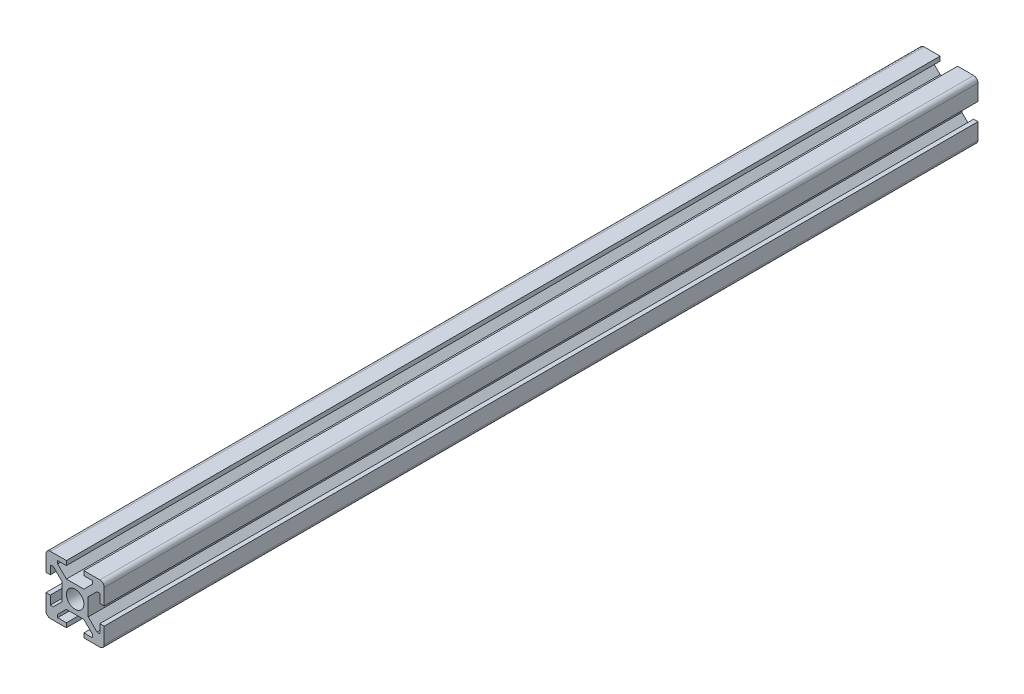
from build123d import *

# Parameters (mm, degrees)
ESQUISSE1_W                  = 20
ESQUISSE1_H                  = 20
EXTRUSION1_DEPTH             = 150
CONG_1_R                     = 1.5
ENL_V_MAT_EXTRU_1_DEPTH      = 301.333148354
R_P_TITION_CIRCULAIRE1_COUNT = 4


with BuildPart() as part:
    # Esquisse1 → Extrusion1 (new, symmetric)
    with BuildSketch(Plane.XY):
        Rectangle(ESQUISSE1_W, ESQUISSE1_H)
    extrude(amount=EXTRUSION1_DEPTH, both=True)

    # Congé1
    cong_1_edges = [part.edges().sort_by_distance(p)[0] for p in [
        (-10, -10, 0),
        (10, -10, 0),
        (-10, 10, 0),
        (10, 10, 0),
    ]]
    fillet(cong_1_edges, radius=CONG_1_R)

    # Esquisse2 → Enlèv. mat.-Extru.1 (cut, through all)
    with BuildSketch(Plane(origin=(0, 0, -150), x_dir=(-1, 0, 0), z_dir=(0, 0, -1))):
        Polygon((-10, 3), (-10, -3), (-8.5, -3), (-8.5, -6), (-7.5, -6), (-4.5, -3), (-4.5, 3), (-7.5, 6), (-8.5, 6), (-8.5, 3), align=None)
    enl_v_mat_extru_1 = extrude(amount=-ENL_V_MAT_EXTRU_1_DEPTH, mode=Mode.SUBTRACT)

    # Répétition circulaire1: Enlèv. mat.-Extru.1 ×4 about axis
    r_p_tition_circulaire1_axis = Axis((0, 0, 9.333809512), (0, 0, -1))
    for i in range(1, R_P_TITION_CIRCULAIRE1_COUNT):
        add(enl_v_mat_extru_1.rotate(r_p_tition_circulaire1_axis, i * 360 / R_P_TITION_CIRCULAIRE1_COUNT), mode=Mode.SUBTRACT)

    # Esquisse5 → Trou taraudé M6x1.01 (revolve, cut)
    with BuildSketch(Plane(origin=(0, 0, -150), x_dir=(0, 1, 0), z_dir=(1, 0, 0))):
        Polygon((0, 0), (0, 31.502151548), (2.5, 30), (2.5, 24), (3, 24), (3, 0), align=None)
    trou_taraud_m6x1_01 = revolve(axis=Axis((0, 0, -156.35), (0, 0, 1)), mode=Mode.SUBTRACT)

    # Symétrie1: Trou taraudé M6x1.01 across plane
    add(trou_taraud_m6x1_01.mirror(Plane.XY), mode=Mode.SUBTRACT)


solid = part.part
